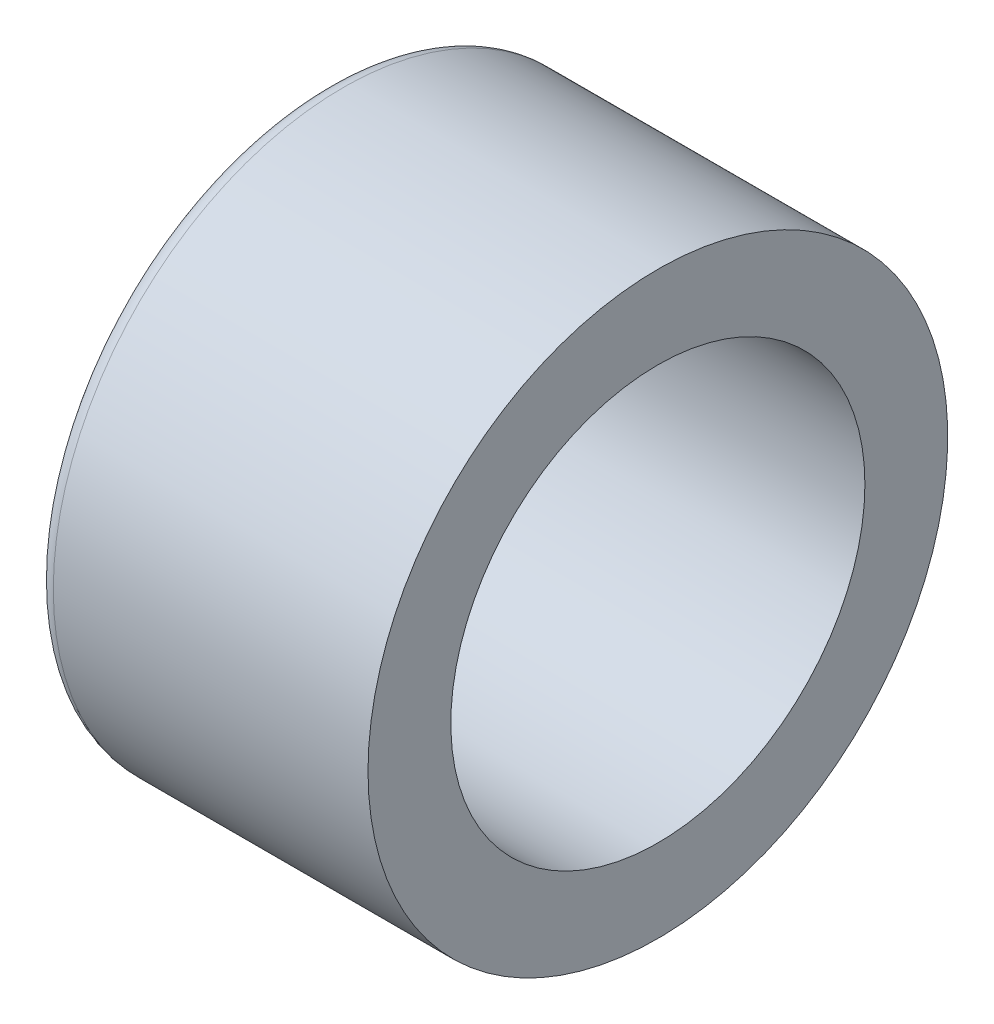
from build123d import *

# Parameters (mm, degrees)
FILLET1_R          = 0.2
FILLET2_R          = 0.2
HEX_2_DEPTH        = 2
SKETCH4_R          = 2.5
CUT_EXTRUDE1_DEPTH = 85.712469332
SKETCH9_R          = 2.5
CUT_EXTRUDE6_DEPTH = 353.231631037


with BuildPart() as part:
    # BodySke → Base-Revolve (revolve)
    with BuildSketch(Plane.XY, mode=Mode.PRIVATE) as base_revolve_sk:
        Polygon((0, 0), (0, 3.5), (4, 3.5), (4, 2), (15.61, 2), (16, 1.61), (16, 0), align=None)
    revolve(base_revolve_sk.sketch.rotate(Axis((-31.75, 0, 0), (1, 0, 0)), 90), axis=Axis((-31.75, 0, 0), (1, 0, 0)))

    # Fillet1
    fillet1_edges = [part.edges().sort_by_distance(p)[0] for p in [
        (4, 0, -2),
    ]]
    fillet(fillet1_edges, radius=FILLET1_R)

    # Fillet2
    fillet2_edges = [part.edges().sort_by_distance(p)[0] for p in [
        (0, 0, -3.5),
    ]]
    fillet(fillet2_edges, radius=FILLET2_R)

    # Sketch2 → Hex-PreBroach (revolve, cut)
    with BuildSketch(Plane.XY, mode=Mode.PRIVATE) as hex_prebroach_sk:
        Polygon((0, 1.5355), (2, 1.5355), (2.886521338, 0), (0, 0), align=None)
    revolve(hex_prebroach_sk.sketch.rotate(Axis((0, 0, 0), (1, 0, 0)), 90), axis=Axis((0, 0, 0), (1, 0, 0)), mode=Mode.SUBTRACT)

    # Sketch3 → Hex 2 (cut)
    with BuildSketch(Plane(origin=(0, 0, 0), x_dir=(0, 0.500000000000001, 0.866025403784438), z_dir=(-1, 0, 0))):
        Polygon((0.886521338, 1.5355), (-0.886521338, 1.5355), (-1.773042677, 0), (-0.886521338, -1.5355), (0.886521338, -1.5355), (1.773042677, 0), align=None)
    extrude(amount=-HEX_2_DEPTH, mode=Mode.SUBTRACT)

    # Sketch4 → Cut-Extrude1 (cut, through all)
    with BuildSketch(Plane(origin=(4, -67.297227621, -41.443909469), x_dir=(0, 0, 1), z_dir=(-1, 0, 0))):
        with Locations((41.443909469, 67.297227621)):
            Circle(SKETCH4_R)
    extrude(amount=-CUT_EXTRUDE1_DEPTH, mode=Mode.SUBTRACT)

    # Sketch9 → Cut-Extrude6 (cut, through all)
    with BuildSketch(Plane(origin=(254, -186.360303269, -149.810753298), x_dir=(0, 0.9242245927363031, 0.3818493186865921), z_dir=(1, 0, 0))):
        with Locations(Location((229.443909469, 67.297227621, 0), (0, 0, 337.551719153))):
            Circle(SKETCH9_R)
    extrude(amount=-CUT_EXTRUDE6_DEPTH, mode=Mode.SUBTRACT)


solid = part.part
